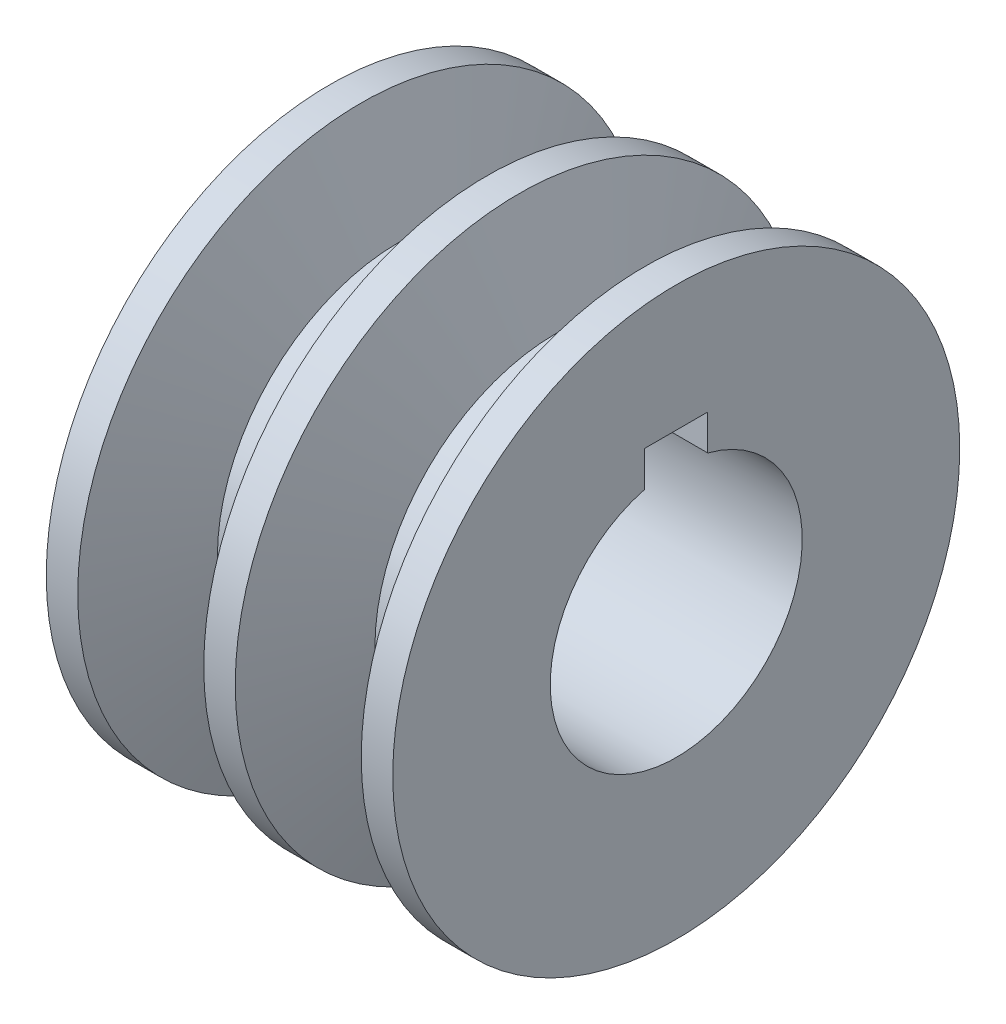
from build123d import *

# Parameters (mm, degrees)
SKETCH1_R           = 28.575
BOSS_EXTRUDE1_DEPTH = 38.1


with BuildPart() as part:
    # Sketch1 → Boss-Extrude1 (new body)
    with BuildSketch(Plane(origin=(0, 0, 0), x_dir=(0, 0, -1), z_dir=(1, 0, 0))):
        Circle(SKETCH1_R)
        with BuildLine():
            ThreePointArc((12.7, 0), (-7.777129933, -10.040231571), (-3.175, 12.296722124))
            Line((-3.175, 12.296722124), (-3.175, 15.875))
            Line((-3.175, 15.875), (3.175, 15.875))
            Line((3.175, 15.875), (3.175, 12.296722124))
            ThreePointArc((3.175, 12.296722124), (10.040231571, 7.777129933), (12.7, 0))
        make_face(mode=Mode.SUBTRACT)
    extrude(amount=BOSS_EXTRUDE1_DEPTH)

    # Sketch2 → Cut-Revolve1 (revolve, cut)
    with BuildSketch(Plane.XY):
        Polygon((0, 28.575), (3.175, 28.575), (6.930717855, 18.25625), (12.119282145, 18.25625), (15.875, 28.575), (19.05, 28.575), (22.805717855, 18.25625), (27.994282145, 18.25625), (31.75, 28.575), (34.925, 28.575), (34.925, 3.709633234), (38.1, 3.709633234), (38.1, 28.575), (38.1, 34.001656794), (0, 34.001656794), align=None)
    revolve(axis=Axis((-1.262943143, 0, 0), (-1, 0, 0)), mode=Mode.SUBTRACT)


solid = part.part
